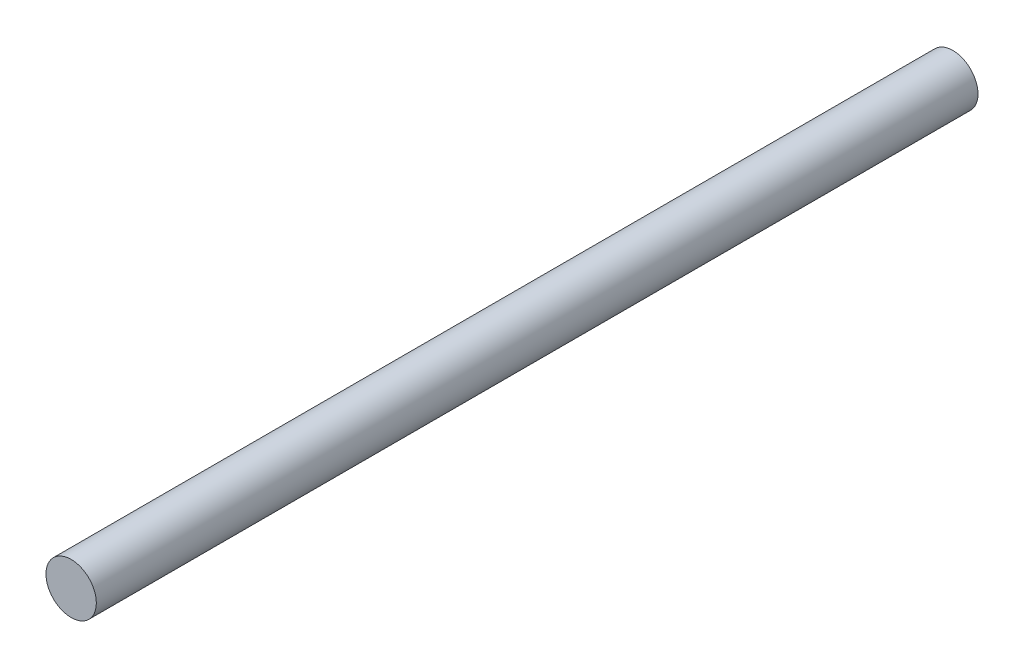
from build123d import *

# Parameters (mm, degrees)
SKETCH_1_R      = 10
EXTRUDE_1_DEPTH = 350


with BuildPart() as part:
    # 草图1 → 凸台-拉伸1 (new body)
    with BuildSketch(Plane.XY):
        Circle(SKETCH_1_R)
    extrude(amount=EXTRUDE_1_DEPTH)


solid = part.part
